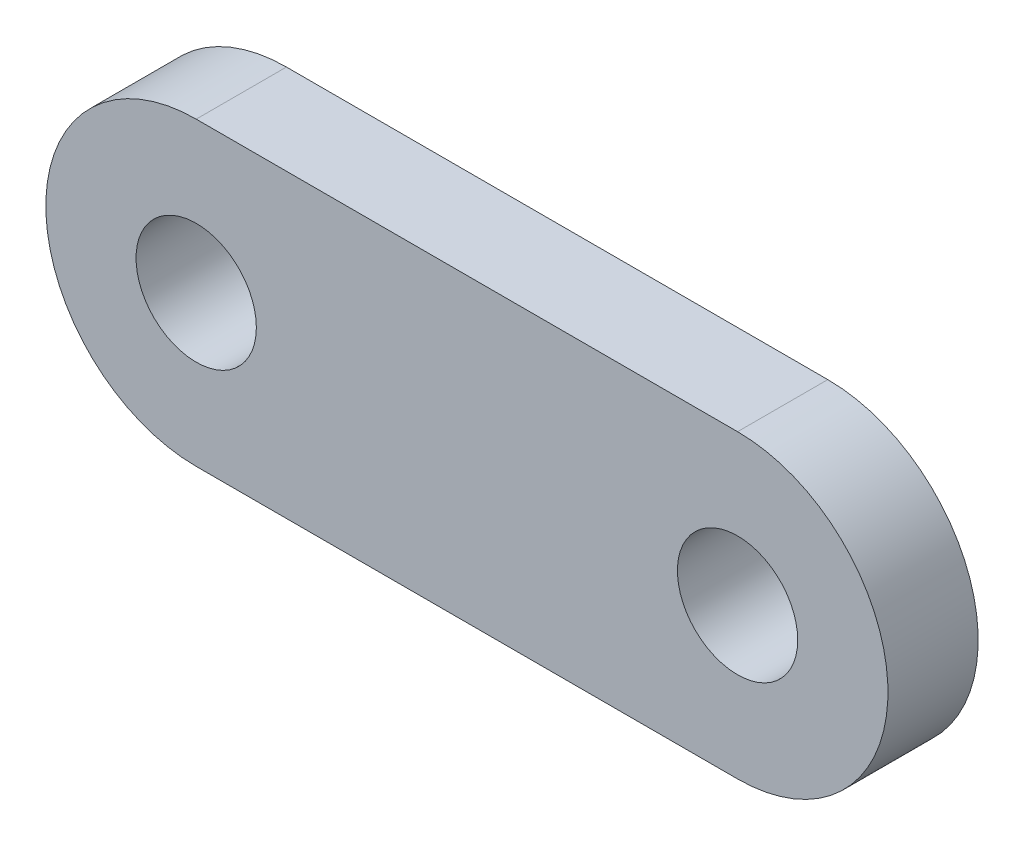
from build123d import *

# Parameters (mm, degrees)
SKETCH1_R           = 2
BOSS_EXTRUDE1_DEPTH = 3


with BuildPart() as part:
    # Sketch1 → Boss-Extrude1 (new body)
    with BuildSketch(Plane.XY):
        with BuildLine():
            Line((-9, 5), (9, 5))
            ThreePointArc((9, 5), (14, 0), (9, -5))
            Line((9, -5), (-9, -5))
            ThreePointArc((-9, -5), (-14, 0), (-9, 5))
        make_face()
        with Locations((-9, 0)):
            Circle(SKETCH1_R, mode=Mode.SUBTRACT)
        with Locations((9, 0)):
            Circle(SKETCH1_R, mode=Mode.SUBTRACT)
    extrude(amount=BOSS_EXTRUDE1_DEPTH)


solid = part.part
